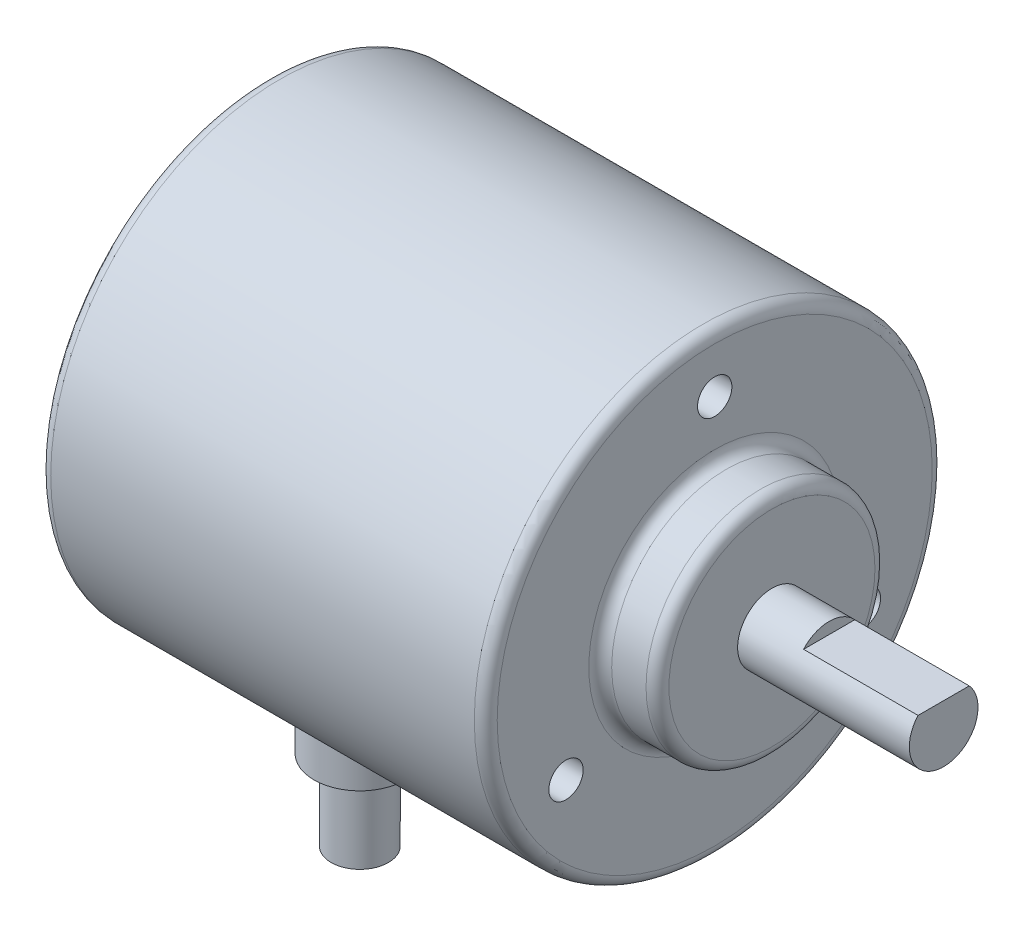
from build123d import *

# Parameters (mm, degrees)
SKETCH2_R                       = 20
BOSS_EXTRUDE1_DEPTH             = 39
SKETCH3_R                       = 10
BOSS_EXTRUDE2_DEPTH             = 5
SKETCH4_R                       = 3
BOSS_EXTRUDE3_DEPTH             = 15
CUT_EXTRUDE1_START              = -10
CUT_EXTRUDE1_DEPTH              = 10
SKETCH6_R                       = 1.5
CUT_EXTRUDE2_DEPTH              = 7
BOSS_EXTRUDE4_REACH             = 76.034
BOSS_EXTRUDE4_END_RADIUS        = 20
SKETCH8_R                       = 4
BOSS_EXTRUDE4_DIRECTION_2_DEPTH = 7.5
SKETCH9_R                       = 2.5
BOSS_EXTRUDE5_DEPTH             = 7
FILLET1_R                       = 1


with BuildPart() as part:
    # Sketch2 → Boss-Extrude1 (new body)
    with BuildSketch(Plane(origin=(0, 0, 0), x_dir=(0, 0, -1), z_dir=(1, 0, 0))):
        Circle(SKETCH2_R)
    extrude(amount=BOSS_EXTRUDE1_DEPTH)

    # Sketch3 → Boss-Extrude2 (add)
    with BuildSketch(Plane(origin=(39, 0, 0), x_dir=(0, 0, -1), z_dir=(1, 0, 0))):
        Circle(SKETCH3_R)
    extrude(amount=BOSS_EXTRUDE2_DEPTH)

    # Sketch4 → Boss-Extrude3 (add)
    with BuildSketch(Plane(origin=(44, 0, 0), x_dir=(0, 0, -1), z_dir=(1, 0, 0))):
        Circle(SKETCH4_R)
    extrude(amount=BOSS_EXTRUDE3_DEPTH)

    # Sketch5 → Cut-Extrude1 (cut)
    with BuildSketch(Plane(origin=(59, 0, 0), x_dir=(0, 0, -1), z_dir=(1, 0, 0)).offset(CUT_EXTRUDE1_START)):
        with BuildLine():
            Line((-2.236067977, 2), (2.236067977, 2))
            ThreePointArc((2.236067977, 2), (0, 3), (-2.236067977, 2))
        make_face()
    extrude(amount=CUT_EXTRUDE1_DEPTH, mode=Mode.SUBTRACT)

    # Sketch6 → Cut-Extrude2 (cut)
    with BuildSketch(Plane(origin=(39, 0, 0), x_dir=(0, 0, -1), z_dir=(1, 0, 0))):
        with Locations((0, 15)):
            Circle(SKETCH6_R)
        with Locations((12.990381057, -7.5)):
            Circle(SKETCH6_R)
        with Locations((-12.990381057, -7.5)):
            Circle(SKETCH6_R)
    extrude(amount=-CUT_EXTRUDE2_DEPTH, mode=Mode.SUBTRACT)

    # Boss-Extrude4: up to this cylinder (the profile starts outside it)
    boss_extrude4_end = Plane(origin=(8, 0, 0), z_dir=(-1, 0, 0)) * Cylinder(BOSS_EXTRUDE4_END_RADIUS, 193.068, mode=Mode.PRIVATE)
    # Sketch8 → Boss-Extrude4 (add, up to the surface)
    with BuildSketch(Plane(origin=(0, -20, 0), x_dir=(1, 0, 0), z_dir=(0, 1, 0)), mode=Mode.PRIVATE) as boss_extrude4_sk1:
        with Locations((8, 0)):
            Circle(SKETCH8_R)
    boss_extrude4_tool1 = extrude(boss_extrude4_sk1.sketch, amount=BOSS_EXTRUDE4_REACH, mode=Mode.PRIVATE) - boss_extrude4_end
    add(boss_extrude4_tool1.solids().sort_by_distance((8, -20, 0))[0])
    add(boss_extrude4_tool1.solids().sort_by_distance((8, -20, 0))[1])

    # Sketch8 → Boss-Extrude4 direction 2 (add)
    with BuildSketch(Plane(origin=(0, -20, 0), x_dir=(1, 0, 0), z_dir=(0, 1, 0))):
        with Locations((8, 0)):
            Circle(SKETCH8_R)
    extrude(amount=-BOSS_EXTRUDE4_DIRECTION_2_DEPTH)

    # Sketch9 → Boss-Extrude5 (add)
    with BuildSketch(Plane.XZ.offset(27.5)):
        with Locations((8, 0)):
            Circle(SKETCH9_R)
    extrude(amount=BOSS_EXTRUDE5_DEPTH)

    # Fillet1
    fillet1_edges = [part.edges().sort_by_distance(p)[0] for p in [
        (0, 0, 20),
        (39, 0, 20),
        (4, -20, 0),
        (5.5, -27.5, 0),
        (39, 0, 10),
        (44, 0, 10),
    ]]
    fillet(fillet1_edges, radius=FILLET1_R)


solid = part.part
